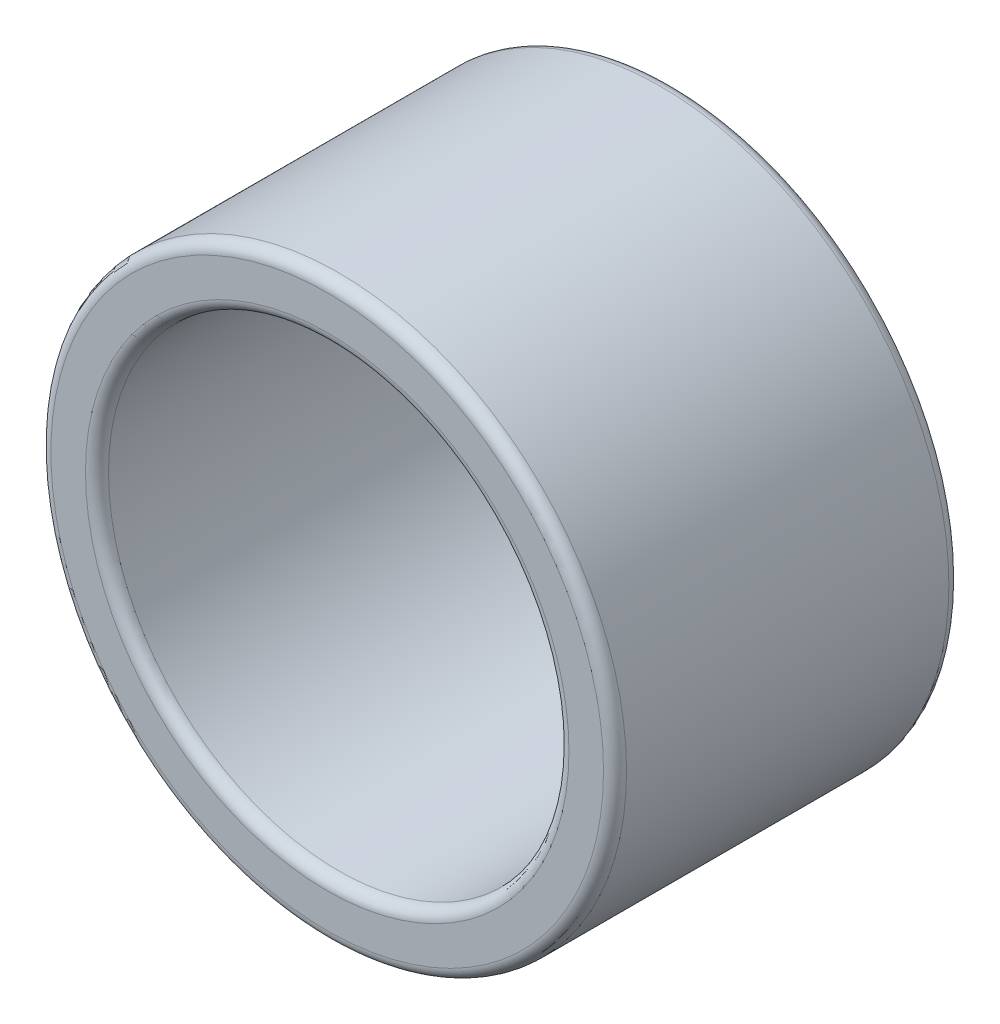
from build123d import *

# Parameters (mm, degrees)
SKETCH1_R           = 7.5
SKETCH1_R_2         = 6
BOSS_EXTRUDE1_DEPTH = 9
FILLET1_R           = 0.3


with BuildPart() as part:
    # Sketch1 → Boss-Extrude1 (new body)
    with BuildSketch(Plane.XY):
        Circle(SKETCH1_R)
        Circle(SKETCH1_R_2, mode=Mode.SUBTRACT)
    extrude(amount=-BOSS_EXTRUDE1_DEPTH)

    # Fillet1
    fillet1_edges = [part.edges().sort_by_distance(p)[0] for p in [
        (-7.5, 0, 0),
        (-7.5, 0, -9),
        (-6, 0, -9),
        (-6, 0, 0),
    ]]
    fillet(fillet1_edges, radius=FILLET1_R)


solid = part.part
